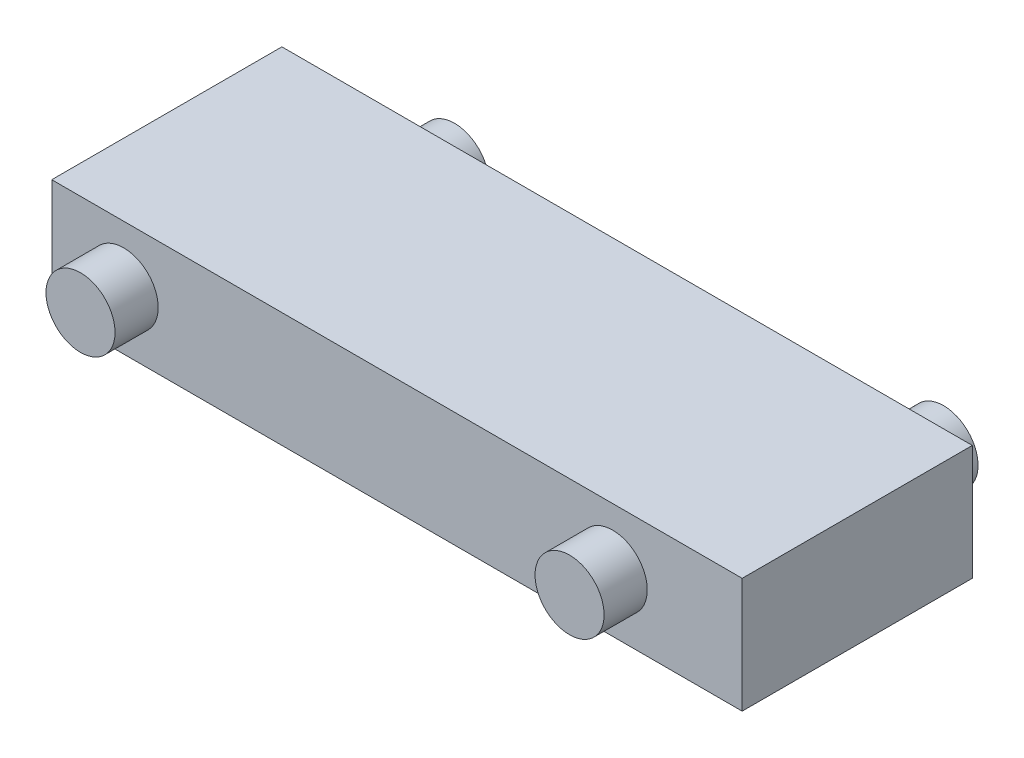
from build123d import *

# Parameters (mm, degrees)
SKETCH_1_W      = 240
SKETCH_1_H      = 40
EXTRUDE_1_DEPTH = 80
SKETCH_2_R      = 12
EXTRUDE_2_DEPTH = 15
SKETCH_3_R      = 12
EXTRUDE_3_DEPTH = 15


with BuildPart() as part:
    # 草图1 → 凸台-拉伸1 (new body)
    with BuildSketch(Plane.XY):
        with Locations((120, 20)):
            Rectangle(SKETCH_1_W, SKETCH_1_H)
    extrude(amount=EXTRUDE_1_DEPTH)

    # 草图2 → 凸台-拉伸2 (add)
    with BuildSketch(Plane(origin=(0, 0, 0), x_dir=(-1, 0, 0), z_dir=(0, 0, -1))):
        with Locations((-215, 20)):
            Circle(SKETCH_2_R)
        with Locations((-45, 20)):
            Circle(SKETCH_2_R)
    extrude(amount=EXTRUDE_2_DEPTH)

    # 草图3 → 凸台-拉伸3 (add)
    with BuildSketch(Plane.XY.offset(80)):
        with Locations(Location((25, 20, 0), (0, 0, 180))):
            Circle(SKETCH_3_R)
        with Locations(Location((195, 20, 0), (0, 0, 180))):
            Circle(SKETCH_3_R)
    extrude(amount=EXTRUDE_3_DEPTH)


solid = part.part
